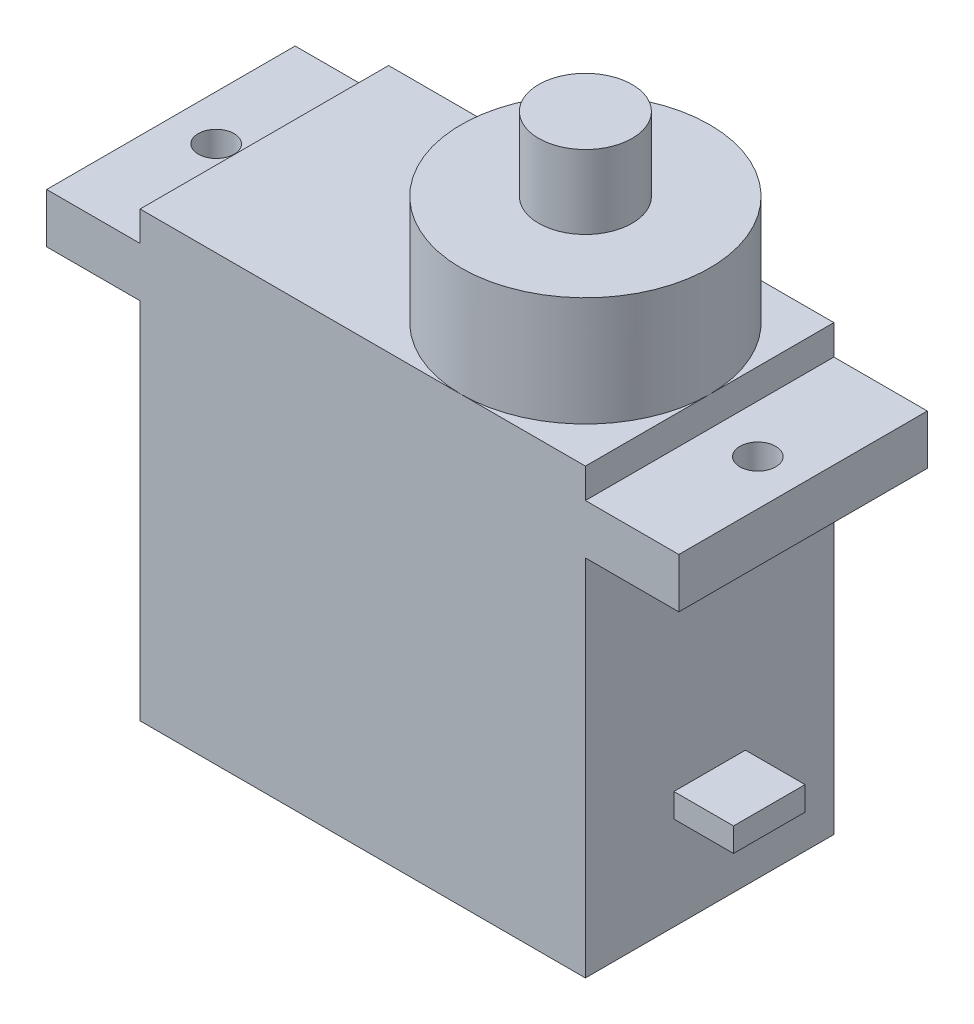
from build123d import *

# Parameters (mm, degrees)
SKETCH_1_W          = 22.4
SKETCH_1_H          = 22.3
EXTRUDE_1_DEPTH     = 12.5
SKETCH_5_R          = 6.25
EXTRUDE_4_DEPTH     = 5.5
SKETCH_6_R          = 2.35
EXTRUDE_5_DEPTH     = 3.7
SKETCH_10_W         = 12.5
SKETCH_10_H         = 2.5
EXTRUDE_8_DEPTH     = 4.7
SKETCH_11_W         = 12.5
SKETCH_11_H         = 2.5
EXTRUDE_9_DEPTH     = 4.7
SKETCH_12_R         = 0.9
CUT_EXTRUDE_2_DEPTH = 4.7
SKETCH_13_W         = 3.6
SKETCH_13_H         = 1.2
EXTRUDE_10_DEPTH    = 3


with BuildPart() as part:
    # 草图1 → 凸台-拉伸1 (new body)
    with BuildSketch(Plane.XY):
        with Locations((11.2, 11.15)):
            Rectangle(SKETCH_1_W, SKETCH_1_H)
    extrude(amount=EXTRUDE_1_DEPTH)

    # 草图5 → 凸台-拉伸4 (add)
    with BuildSketch(Plane(origin=(0, 22.3, 0), x_dir=(1, 0, 0), z_dir=(0, 1, 0))):
        with Locations(Location((16.15, -6.25, 0), (0, 0, 270))):
            Circle(SKETCH_5_R)
    extrude(amount=EXTRUDE_4_DEPTH)

    # 草图6 → 凸台-拉伸5 (add)
    with BuildSketch(Plane(origin=(0, 27.8, 0), x_dir=(1, 0, 0), z_dir=(0, 1, 0))):
        with Locations(Location((16.15, -6.25, 0), (0, 0, 270))):
            Circle(SKETCH_6_R)
    extrude(amount=EXTRUDE_5_DEPTH)

    # 草图10 → 凸台-拉伸8 (add)
    with BuildSketch(Plane(origin=(22.4, 0, 0), x_dir=(0, 0, -1), z_dir=(1, 0, 0))):
        with Locations((-6.25, 19.55)):
            Rectangle(SKETCH_10_W, SKETCH_10_H)
    extrude(amount=EXTRUDE_8_DEPTH)

    # 草图11 → 凸台-拉伸9 (add)
    with BuildSketch(Plane.ZY):
        with Locations((6.25, 19.55)):
            Rectangle(SKETCH_11_W, SKETCH_11_H)
    extrude(amount=EXTRUDE_9_DEPTH)

    # 草图12 → 切除-拉伸2 (cut)
    with BuildSketch(Plane(origin=(0, 20.8, 0), x_dir=(1, 0, 0), z_dir=(0, 1, 0))):
        with Locations(Location((-2.422009123, -6.25, 0), (0, 0, 270))):
            Circle(SKETCH_12_R)
        with Locations(Location((24.822009123, -6.25, 0), (0, 0, 270))):
            Circle(SKETCH_12_R)
    extrude(amount=-CUT_EXTRUDE_2_DEPTH, mode=Mode.SUBTRACT)

    # 草图13 → 凸台-拉伸10 (add)
    with BuildSketch(Plane(origin=(22.4, 0, 0), x_dir=(0, 0, -1), z_dir=(1, 0, 0))):
        with Locations((-6.25, 5.3)):
            Rectangle(SKETCH_13_W, SKETCH_13_H)
    extrude(amount=EXTRUDE_10_DEPTH)


solid = part.part
